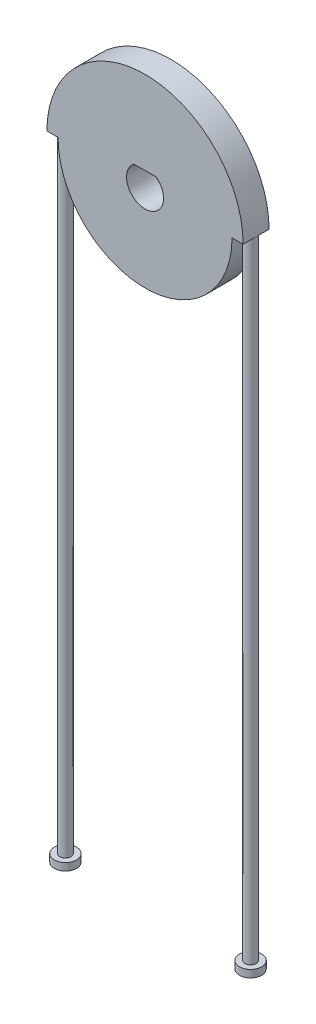
from build123d import *

# Parameters (mm, degrees)
CUT_EXTRUDE1_DEPTH  = 9
CUT_EXTRUDE2_START  = -7
CUT_EXTRUDE2_DEPTH  = 7
SKETCH6_R           = 1.5
BOSS_EXTRUDE1_DEPTH = 170
SKETCH7_R           = 3
BOSS_EXTRUDE2_DEPTH = 2


with BuildPart() as part:
    # Sketch2 → Revolve1 (revolve)
    with BuildSketch(Plane(origin=(0, 0, 0), x_dir=(0, 0, -1), z_dir=(1, 0, 0)), mode=Mode.PRIVATE) as revolve1_sk:
        Polygon((-3.561959221, 0), (3.438040779, 0), (3.438040779, 26.5), (1.438040779, 26.5), (-1.561959221, 26.5), (-3.561959221, 26.5), align=None)
    revolve(revolve1_sk.sketch.rotate(Axis((0, 0, 3.561959221), (0, 0, -1)), 90), axis=Axis((0, 0, 3.561959221), (0, 0, -1)))

    # Sketch3 → Cut-Extrude1 (cut)
    with BuildSketch(Plane(origin=(0, 0, -3.438040779), x_dir=(-1, 0, 0), z_dir=(0, 0, -1))):
        with BuildLine():
            Line((-2.95661762, 4.03217215), (3.043032331, 3.967361117))
            ThreePointArc((3.043032331, 3.967361117), (-0.054009195, -4.999708292), (-2.95661762, 4.03217215))
        make_face()
    extrude(amount=-CUT_EXTRUDE1_DEPTH, mode=Mode.SUBTRACT)

    # Sketch5 → Cut-Extrude2 (cut)
    with BuildSketch(Plane(origin=(0, 0, -3.438040779), x_dir=(-1, 0, 0), z_dir=(0, 0, -1)).offset(CUT_EXTRUDE2_START)):
        with BuildLine():
            Line((-26.5, 0), (-23.5, 0))
            ThreePointArc((-23.5, 0), (0, -23.5), (23.5, 0))
            Line((23.5, 0), (26.5, 0))
            ThreePointArc((26.5, 0), (0, -26.5), (-26.5, 0))
        make_face()
    extrude(amount=CUT_EXTRUDE2_DEPTH, mode=Mode.SUBTRACT)

    # Sketch6 → Boss-Extrude1 (add)
    with BuildSketch(Plane.XZ):
        with Locations(Location((25, 0.061959221, 0), (0, 0, 180))):
            Circle(SKETCH6_R)
        with Locations(Location((-25, 0.061959221, 0), (0, 0, 180))):
            Circle(SKETCH6_R)
    extrude(amount=BOSS_EXTRUDE1_DEPTH)

    # Sketch7 → Boss-Extrude2 (add)
    with BuildSketch(Plane.XZ.offset(170)):
        with Locations(Location((25, 0.061959221, 0), (0, 0, 270))):
            Circle(SKETCH7_R)
        with Locations(Location((-25, 0.061959221, 0), (0, 0, 270))):
            Circle(SKETCH7_R)
    extrude(amount=BOSS_EXTRUDE2_DEPTH)


solid = part.part
